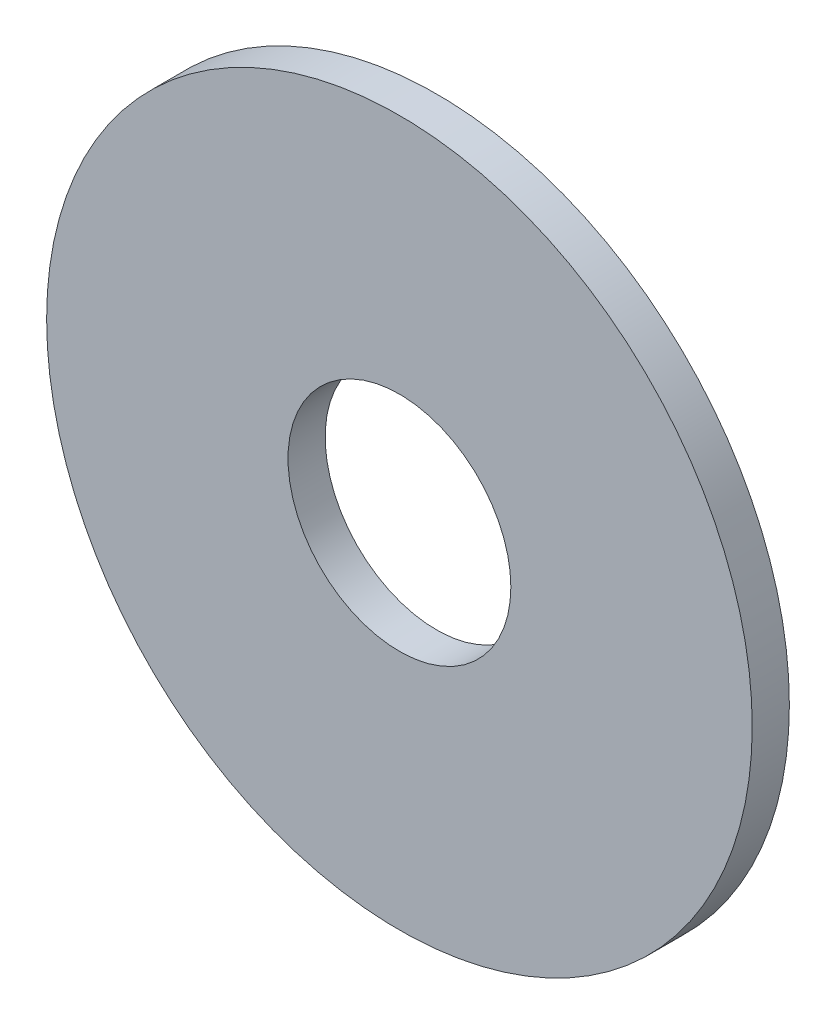
from build123d import *

# Parameters (mm, degrees)
SKETCH_1_R      = 9.5
SKETCH_1_R_2    = 3
EXTRUDE_1_DEPTH = 1


with BuildPart() as part:
    # 草图1 → 凸台-拉伸1 (new body)
    with BuildSketch(Plane.XY):
        Circle(SKETCH_1_R)
        Circle(SKETCH_1_R_2, mode=Mode.SUBTRACT)
    extrude(amount=EXTRUDE_1_DEPTH)


solid = part.part
